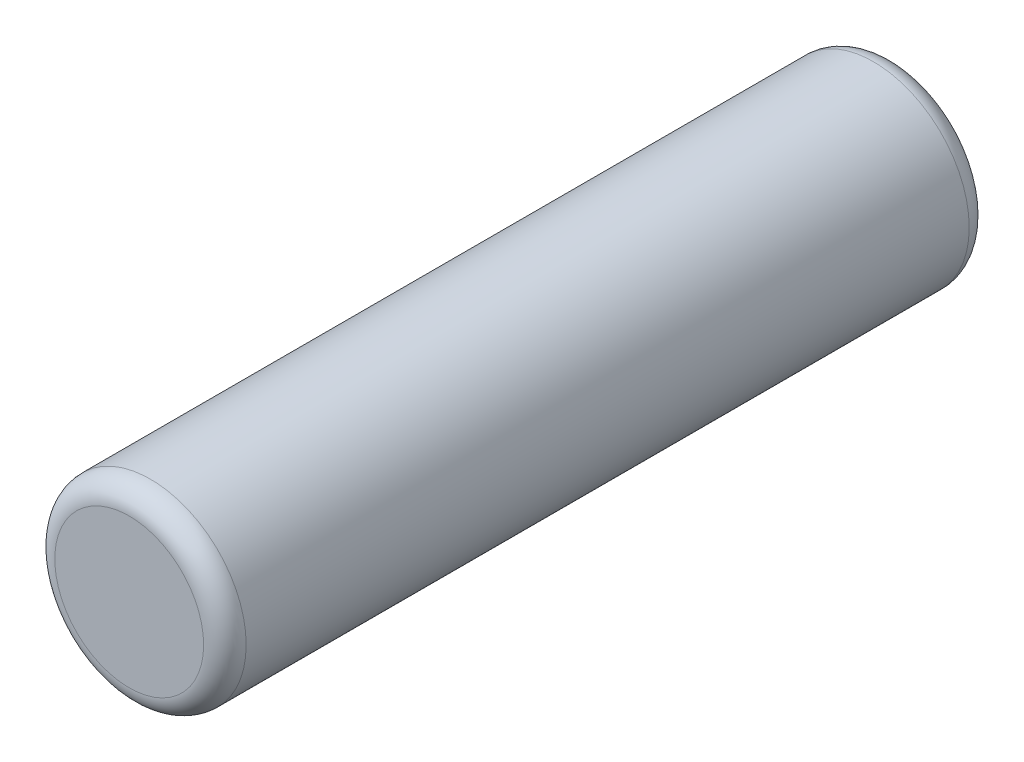
from build123d import *

# Parameters (mm, degrees)
ESQUISSE1_R        = 57.15
BOSS_EXTRU_1_DEPTH = 457.2
CONG_1_R           = 12.7


with BuildPart() as part:
    # Esquisse1 → Boss.-Extru.1 (new body)
    with BuildSketch(Plane.XY):
        Circle(ESQUISSE1_R)
    extrude(amount=BOSS_EXTRU_1_DEPTH)

    # Congé1
    cong_1_edges = [part.edges().sort_by_distance(p)[0] for p in [
        (-57.15, 0, 0),
        (-57.15, 0, 457.2),
    ]]
    fillet(cong_1_edges, radius=CONG_1_R)


solid = part.part
